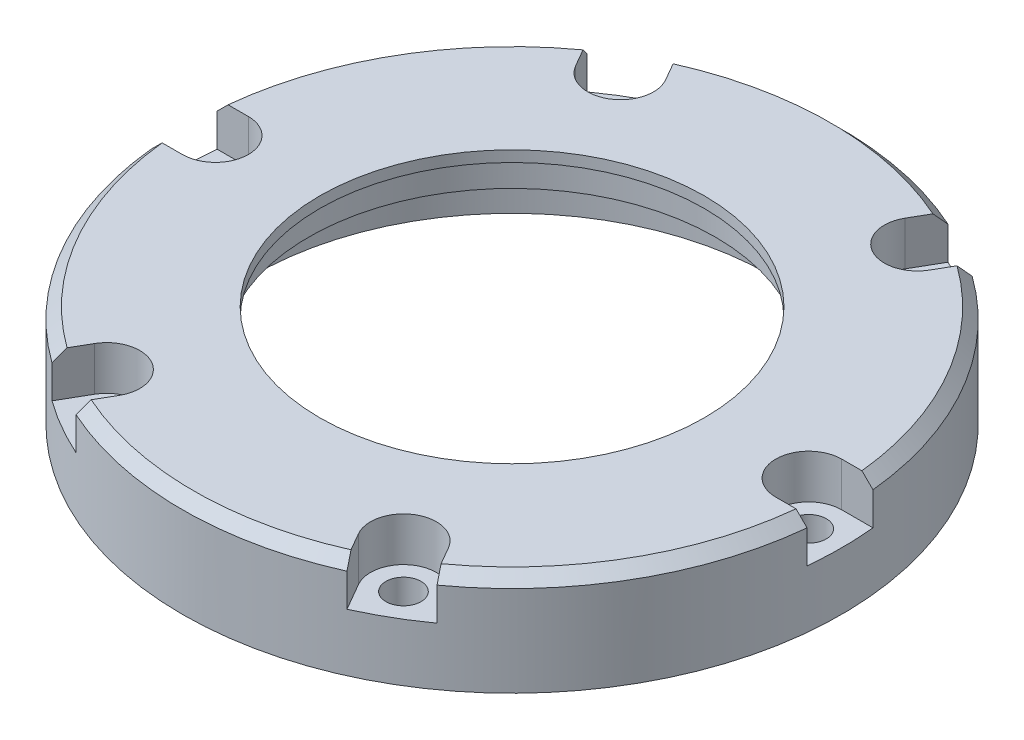
from build123d import *

# Parameters (mm, degrees)
SKETCH1_R           = 30
SKETCH1_R_2         = 17.5
BOSS_EXTRUDE1_DEPTH = 9.25
SKETCH2_R           = 1.6
CUT_EXTRUDE1_DEPTH  = 9.25
CUT_EXTRUDE2_DEPTH  = 4
SKETCH4_R           = 23.5
CUT_EXTRUDE3_DEPTH  = 5.5
SKETCH5_R           = 18.5
CUT_EXTRUDE4_DEPTH  = 8.25
CIRPATTERN1_COUNT   = 6
CHAMFER1_SIZE       = 1


with BuildPart() as part:
    # Sketch1 → Boss-Extrude1 (new body)
    with BuildSketch(Plane(origin=(0, 0, 0), x_dir=(1, 0, 0), z_dir=(0, 1, 0))):
        with Locations(Location((0, 0, 0), (0, 0, 270))):
            Circle(SKETCH1_R)
        with Locations(Location((0, 0, 0), (0, 0, 270))):
            Circle(SKETCH1_R_2, mode=Mode.SUBTRACT)
    extrude(amount=BOSS_EXTRUDE1_DEPTH)

    # Sketch2 → Cut-Extrude1 (cut)
    with BuildSketch(Plane(origin=(0, 9.25, 0), x_dir=(1, 0, 0), z_dir=(0, 1, 0))):
        with Locations(Location((-27, 0, 0), (0, 0, 270))):
            Circle(SKETCH2_R)
    cut_extrude1 = extrude(amount=-CUT_EXTRUDE1_DEPTH, mode=Mode.SUBTRACT)

    # Sketch3 → Cut-Extrude2 (cut)
    with BuildSketch(Plane(origin=(0, 9.25, 0), x_dir=(1, 0, 0), z_dir=(0, 1, 0))):
        with BuildLine():
            Line((-27, 3), (-31.510174131, 3))
            Line((-31.510174131, 3), (-31.510174131, -3))
            Line((-31.510174131, -3), (-27, -3))
            ThreePointArc((-27, -3), (-24, 0), (-27, 3))
        make_face()
    cut_extrude2 = extrude(amount=-CUT_EXTRUDE2_DEPTH, mode=Mode.SUBTRACT)

    # Sketch4 → Cut-Extrude3 (cut)
    with BuildSketch(Plane.XZ):
        with Locations(Location((0, 0, 0), (0, 0, 270))):
            Circle(SKETCH4_R)
    extrude(amount=-CUT_EXTRUDE3_DEPTH, mode=Mode.SUBTRACT)

    # Sketch5 → Cut-Extrude4 (cut)
    with BuildSketch(Plane.XZ):
        with Locations(Location((0, 0, 0), (0, 0, 270))):
            Circle(SKETCH5_R)
    extrude(amount=-CUT_EXTRUDE4_DEPTH, mode=Mode.SUBTRACT)

    # CirPattern1: Cut-Extrude1, Cut-Extrude2 ×6 about axis
    cirpattern1_axis = Axis((0, 0, 0), (0, 1, 0))
    add([cut_extrude1.rotate(cirpattern1_axis, i * 360 / CIRPATTERN1_COUNT) for i in range(1, CIRPATTERN1_COUNT)], mode=Mode.SUBTRACT)
    add([cut_extrude2.rotate(cirpattern1_axis, i * 360 / CIRPATTERN1_COUNT) for i in range(1, CIRPATTERN1_COUNT)], mode=Mode.SUBTRACT)

    # Chamfer1
    chamfer1_edges = [part.edges().sort_by_distance(p)[0] for p in [
        (-25.980762114, 9.25, 15),
        (6.304127327, 9.25, 29.330154767),
        (25.980762114, 9.25, 15),
        (25.980762114, 9.25, -15),
        (0, 9.25, -30),
        (-25.980762114, 9.25, -15),
    ]]
    chamfer(chamfer1_edges, length=CHAMFER1_SIZE)


solid = part.part
